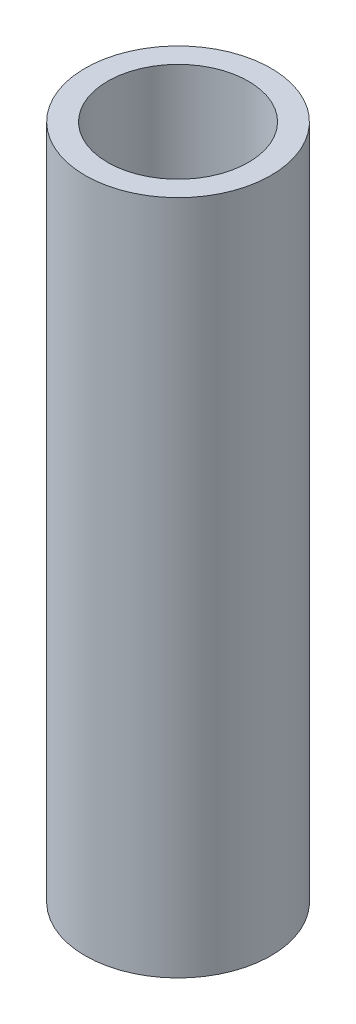
from build123d import *

# Parameters (mm, degrees)
SKETCH1_R           = 0.825
SKETCH1_R_2         = 0.625
BOSS_EXTRUDE1_DEPTH = 6


with BuildPart() as part:
    # Sketch1 → Boss-Extrude1 (new body)
    with BuildSketch(Plane(origin=(0, 0, 0), x_dir=(1, 0, 0), z_dir=(0, 1, 0))):
        with Locations(Location((0, 0, 0), (0, 0, 270))):
            Circle(SKETCH1_R)
        with Locations(Location((0, 0, 0), (0, 0, 270))):
            Circle(SKETCH1_R_2, mode=Mode.SUBTRACT)
    extrude(amount=BOSS_EXTRUDE1_DEPTH)


solid = part.part
